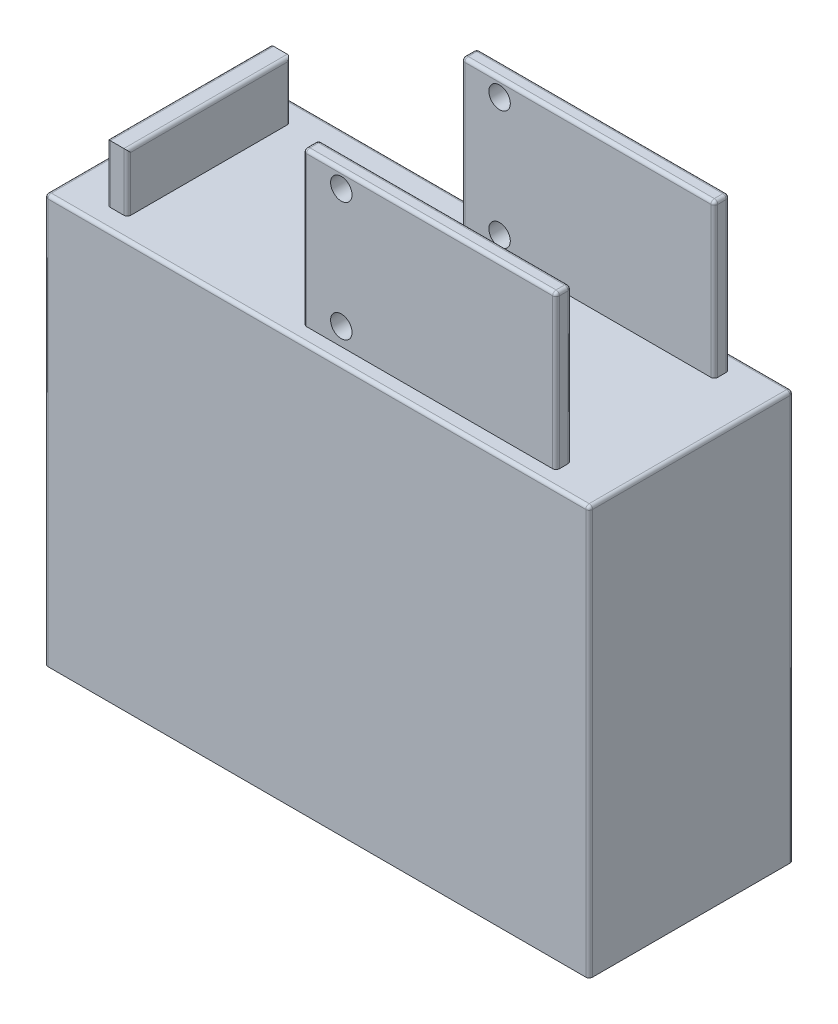
from build123d import *

# Parameters (mm, degrees)
SKETCH1_W           = 80
SKETCH1_H           = 60
BOSS_EXTRUDE1_DEPTH = 30
SKETCH2_W           = 37.144630664
SKETCH2_H           = 2.25
BOSS_EXTRUDE2_DEPTH = 22.5
SKETCH3_W           = 3
SKETCH3_H           = 24
BOSS_EXTRUDE3_DEPTH = 8.5
SKETCH5_R           = 1.575
CUT_EXTRUDE1_DEPTH  = 30
FILLET2_R           = 0.5


with BuildPart() as part:
    # Sketch1 → Boss-Extrude1 (new body)
    with BuildSketch(Plane.XY):
        with Locations((-96.427201848, 129.115774072)):
            Rectangle(SKETCH1_W, SKETCH1_H)
    extrude(amount=BOSS_EXTRUDE1_DEPTH)

    # Sketch2 → Boss-Extrude2 (add)
    with BuildSketch(Plane(origin=(0, 159.115774072, 0), x_dir=(1, 0, 0), z_dir=(0, 1, 0))):
        with Locations((-82.11807708, -3.375)):
            Rectangle(SKETCH2_W, SKETCH2_H)
        with Locations((-82.11807708, -26.625)):
            Rectangle(SKETCH2_W, SKETCH2_H)
    extrude(amount=BOSS_EXTRUDE2_DEPTH)

    # Sketch3 → Boss-Extrude3 (add)
    with BuildSketch(Plane(origin=(0, 159.115774072, 0), x_dir=(1, 0, 0), z_dir=(0, 1, 0))):
        with Locations((-128.777201848, -15)):
            Rectangle(SKETCH3_W, SKETCH3_H)
    extrude(amount=BOSS_EXTRUDE3_DEPTH)

    # Sketch5 → Cut-Extrude1 (cut)
    with BuildSketch(Plane(origin=(0, 0, 2.25), x_dir=(-1, 0, 0), z_dir=(0, 0, -1))):
        with Locations((95.090392412, 161.715774072)):
            Circle(SKETCH5_R)
        with Locations((95.090392412, 179.215774072)):
            Circle(SKETCH5_R)
    extrude(amount=-CUT_EXTRUDE1_DEPTH, mode=Mode.SUBTRACT)

    # Fillet2
    fillet2_edges = [part.edges().sort_by_distance(p)[0] for p in [
        (-56.427201848, 129.115774072, 30),
        (-100.690392412, 170.365774072, 2.25),
        (-100.690392412, 170.365774072, 4.5),
        (-96.427201848, 159.115774072, 30),
        (-63.545761748, 170.365774072, 4.5),
        (-63.545761748, 170.365774072, 2.25),
        (-100.690392412, 181.615774072, 3.375),
        (-82.11807708, 181.615774072, 4.5),
        (-63.545761748, 181.615774072, 3.375),
        (-82.11807708, 181.615774072, 2.25),
        (-100.690392412, 170.365774072, 25.5),
        (-100.690392412, 170.365774072, 27.75),
        (-63.545761748, 170.365774072, 27.75),
        (-63.545761748, 170.365774072, 25.5),
        (-100.690392412, 181.615774072, 26.625),
        (-82.11807708, 181.615774072, 27.75),
        (-63.545761748, 181.615774072, 26.625),
        (-82.11807708, 181.615774072, 25.5),
        (-130.277201848, 163.365774072, 3),
        (-130.277201848, 163.365774072, 27),
        (-127.277201848, 163.365774072, 27),
        (-127.277201848, 163.365774072, 3),
        (-130.277201848, 167.615774072, 15),
        (-127.277201848, 167.615774072, 15),
        (-136.427201848, 129.115774072, 30),
        (-96.427201848, 159.115774072, 0),
        (-56.427201848, 129.115774072, 0),
        (-136.427201848, 129.115774072, 0),
        (-136.427201848, 159.115774072, 15),
        (-56.427201848, 159.115774072, 15),
    ]]
    fillet(fillet2_edges, radius=FILLET2_R)


solid = part.part
